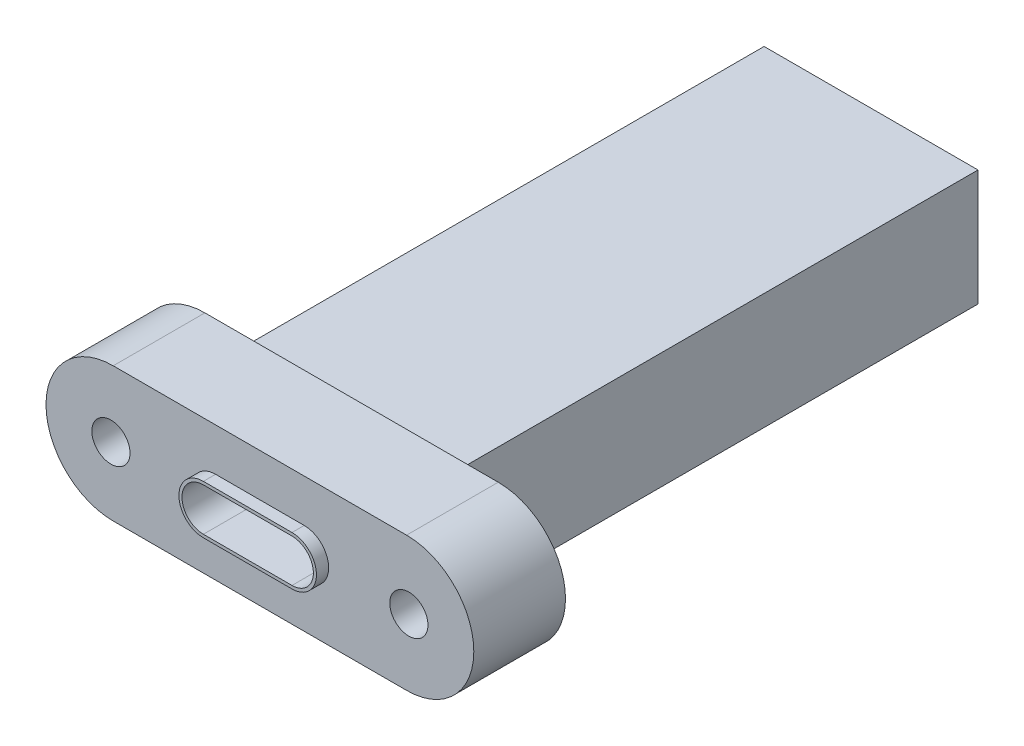
from build123d import *

# Parameters (mm, degrees)
SKETCH_1_W          = 14
SKETCH_1_H          = 7.6
EXTRUDE_1_DEPTH     = 34
EXTRUDE_2_DEPTH     = 6
EXTRUDE_3_DEPTH     = 0.8
CUT_EXTRUDE_1_DEPTH = 5
HOLE_WIZARD_M3_1_D  = 2.5


with BuildPart() as part:
    # 草图1 → 凸台-拉伸1 (new body)
    with BuildSketch(Plane.XY):
        Rectangle(SKETCH_1_W, SKETCH_1_H)
    extrude(amount=EXTRUDE_1_DEPTH)

    # 草图2 → 凸台-拉伸2 (add)
    with BuildSketch(Plane.XY.offset(34)):
        with BuildLine():
            Line((-9.6, 4.4), (9.6, 4.4))
            ThreePointArc((9.6, 4.4), (14, 0), (9.6, -4.4))
            Line((9.6, -4.4), (-9.6, -4.4))
            ThreePointArc((-9.6, -4.4), (-14, 0), (-9.6, 4.4))
        make_face()
    extrude(amount=EXTRUDE_2_DEPTH)

    # 草图3 → 凸台-拉伸3 (add)
    with BuildSketch(Plane.XY.offset(40)):
        with BuildLine():
            Line((-2.9, 1.6), (2.9, 1.6))
            ThreePointArc((2.9, 1.6), (4.5, 0), (2.9, -1.6))
            Line((2.9, -1.6), (-2.9, -1.6))
            ThreePointArc((-2.9, -1.6), (-4.5, 0), (-2.9, 1.6))
        make_face()
    extrude(amount=EXTRUDE_3_DEPTH)

    # 草图4 → 切除-拉伸1 (cut)
    with BuildSketch(Plane.XY.offset(40.8)):
        with BuildLine():
            Line((-2.9, -1.4), (2.9, -1.4))
            ThreePointArc((2.9, -1.4), (4.3, 0), (2.9, 1.4))
            Line((2.9, 1.4), (-2.9, 1.4))
            ThreePointArc((-2.9, 1.4), (-4.3, 0), (-2.9, -1.4))
        make_face()
    extrude(amount=-CUT_EXTRUDE_1_DEPTH, mode=Mode.SUBTRACT)

    # M3 螺纹孔1 (through all)
    with Locations(Plane.XY.offset(40)):
        with Locations((-9.75, 0), (9.75, 0)):
            Hole(HOLE_WIZARD_M3_1_D / 2)


solid = part.part
